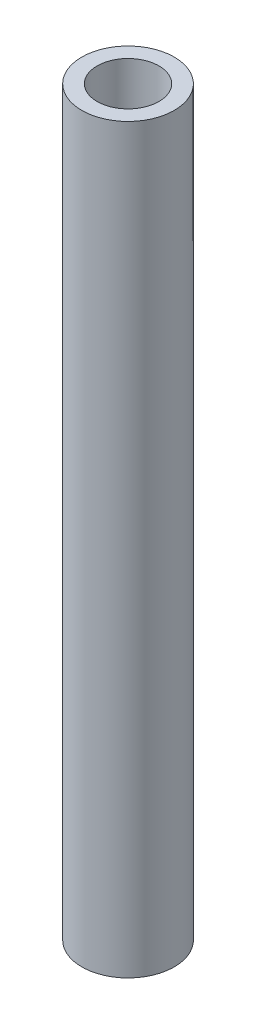
from build123d import *

# Parameters (mm, degrees)
SKETCH1_R           = 2.3749
BOSS_EXTRUDE1_DEPTH = 38.1
SKETCH2_R           = 1.5875
CUT_EXTRUDE1_DEPTH  = 39.247748954


with BuildPart() as part:
    # Sketch1 → Boss-Extrude1 (new body)
    with BuildSketch(Plane(origin=(0, 0, 0), x_dir=(1, 0, 0), z_dir=(0, 1, 0))):
        with Locations(Location((0, 0, 0), (0, 0, 90))):
            Circle(SKETCH1_R)
    extrude(amount=BOSS_EXTRUDE1_DEPTH)

    # Sketch2 → Cut-Extrude1 (cut, through all)
    with BuildSketch(Plane(origin=(0, 38.1, 0), x_dir=(1, 0, 0), z_dir=(0, 1, 0))):
        with Locations(Location((0, 0, 0), (0, 0, 270))):
            Circle(SKETCH2_R)
    extrude(amount=-CUT_EXTRUDE1_DEPTH, mode=Mode.SUBTRACT)


solid = part.part
